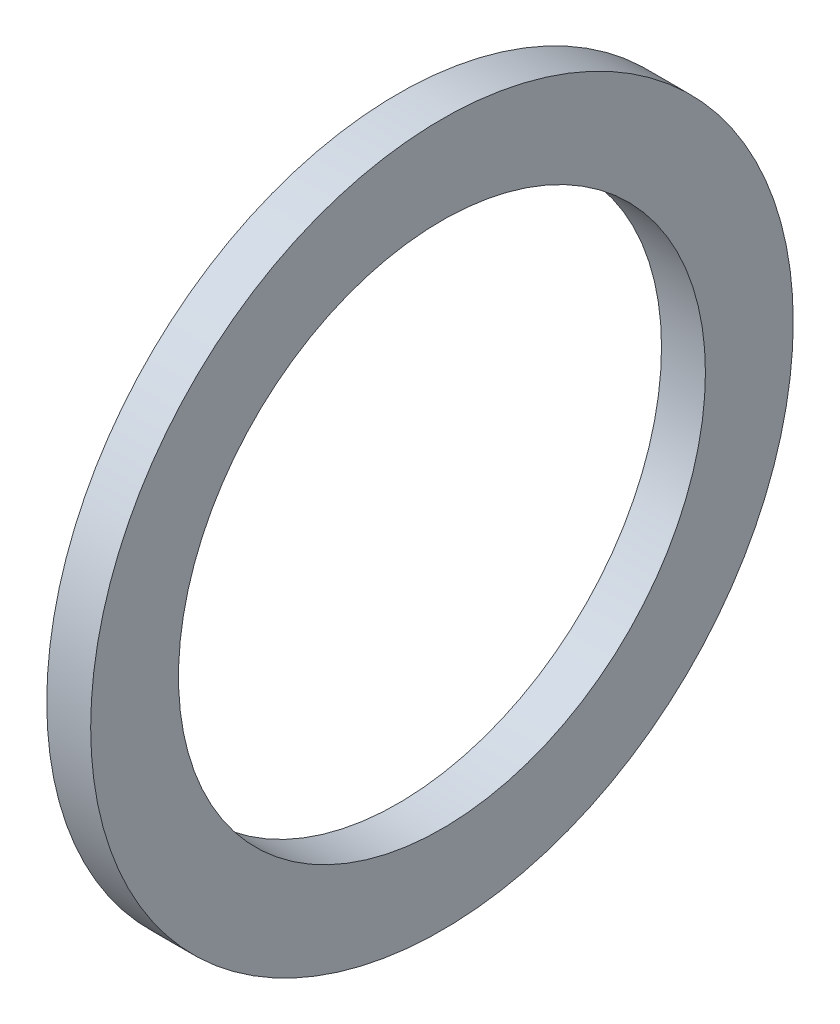
from build123d import *

# Parameters (mm, degrees)
SKETCH1_R           = 12.7
SKETCH1_R_2         = 9.525
BOSS_EXTRUDE1_DEPTH = 1.5875


with BuildPart() as part:
    # Sketch1 → Boss-Extrude1 (new body)
    with BuildSketch(Plane(origin=(0, 0, 0), x_dir=(0, 0, -1), z_dir=(1, 0, 0))):
        Circle(SKETCH1_R)
        Circle(SKETCH1_R_2, mode=Mode.SUBTRACT)
    extrude(amount=BOSS_EXTRUDE1_DEPTH)


solid = part.part
